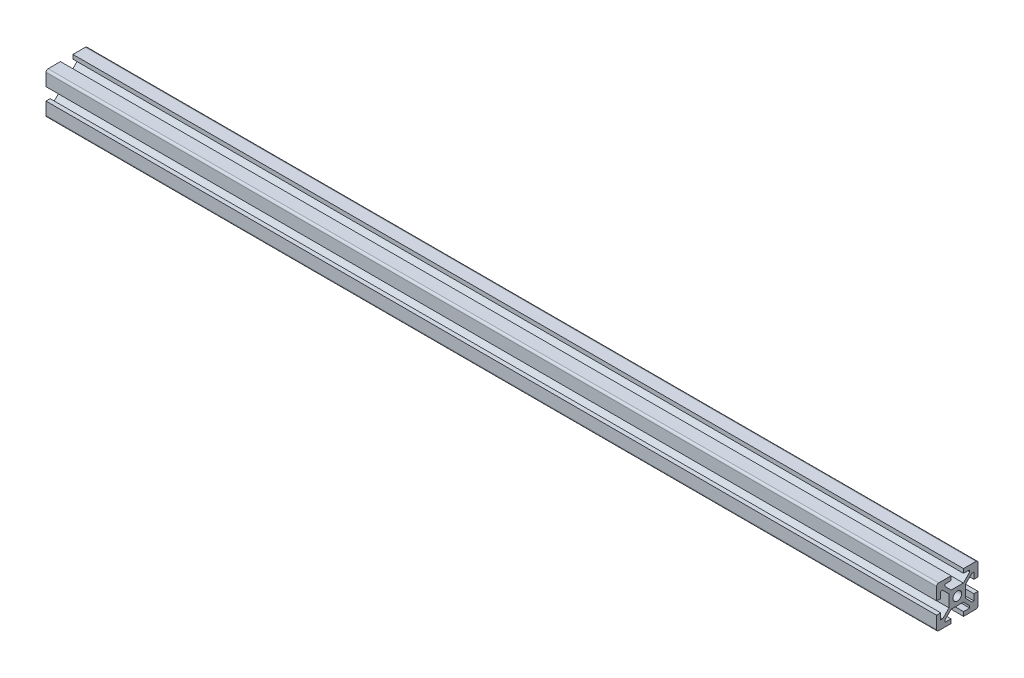
from build123d import *

# Parameters (mm, degrees)
SKETCH1_R           = 2.1
BOSS_EXTRUDE1_DEPTH = 430


with BuildPart() as part:
    # Sketch1 → Boss-Extrude1 (new body)
    with BuildSketch(Plane(origin=(0, 0, 0), x_dir=(0, 0, -1), z_dir=(1, 0, 0))):
        with BuildLine():
            Line((-10, 9), (-10, 3))
            Line((-10, 3), (-8, 3))
            Line((-8, 3), (-8, 6))
            Line((-8, 6), (-7.060660172, 6))
            Line((-7.060660172, 6), (-4, 2.939339828))
            Line((-4, 2.939339828), (-4, -2.939339828))
            Line((-4, -2.939339828), (-7.060660172, -6))
            Line((-7.060660172, -6), (-8, -6))
            Line((-8, -6), (-8, -3))
            Line((-8, -3), (-10, -3))
            Line((-10, -3), (-10, -9))
            ThreePointArc((-10, -9), (-9.707106781, -9.707106781), (-9, -10))
            Line((-9, -10), (-3, -10))
            Line((-3, -10), (-3, -8))
            Line((-3, -8), (-6, -8))
            Line((-6, -8), (-6, -7.060660172))
            Line((-6, -7.060660172), (-2.939339828, -4))
            Line((-2.939339828, -4), (2.939339828, -4))
            Line((2.939339828, -4), (6, -7.060660172))
            Line((6, -7.060660172), (6, -8))
            Line((6, -8), (3, -8))
            Line((3, -8), (3, -10))
            Line((3, -10), (9, -10))
            ThreePointArc((9, -10), (9.707106781, -9.707106781), (10, -9))
            Line((10, -9), (10, -3))
            Line((10, -3), (8, -3))
            Line((8, -3), (8, -6))
            Line((8, -6), (7.060660172, -6))
            Line((7.060660172, -6), (4, -2.939339828))
            Line((4, -2.939339828), (4, 2.939339828))
            Line((4, 2.939339828), (7.060660172, 6))
            Line((7.060660172, 6), (8, 6))
            Line((8, 6), (8, 3))
            Line((8, 3), (10, 3))
            Line((10, 3), (10, 9))
            ThreePointArc((10, 9), (9.707106781, 9.707106781), (9, 10))
            Line((9, 10), (3, 10))
            Line((3, 10), (3, 8))
            Line((3, 8), (6, 8))
            Line((6, 8), (6, 7.060660172))
            Line((6, 7.060660172), (2.939339828, 4))
            Line((2.939339828, 4), (-2.939339828, 4))
            Line((-2.939339828, 4), (-6, 7.060660172))
            Line((-6, 7.060660172), (-6, 8))
            Line((-6, 8), (-3, 8))
            Line((-3, 8), (-3, 10))
            Line((-3, 10), (-9, 10))
            ThreePointArc((-9, 10), (-9.707106781, 9.707106781), (-10, 9))
        make_face()
        Circle(SKETCH1_R, mode=Mode.SUBTRACT)
    extrude(amount=BOSS_EXTRUDE1_DEPTH)


solid = part.part
